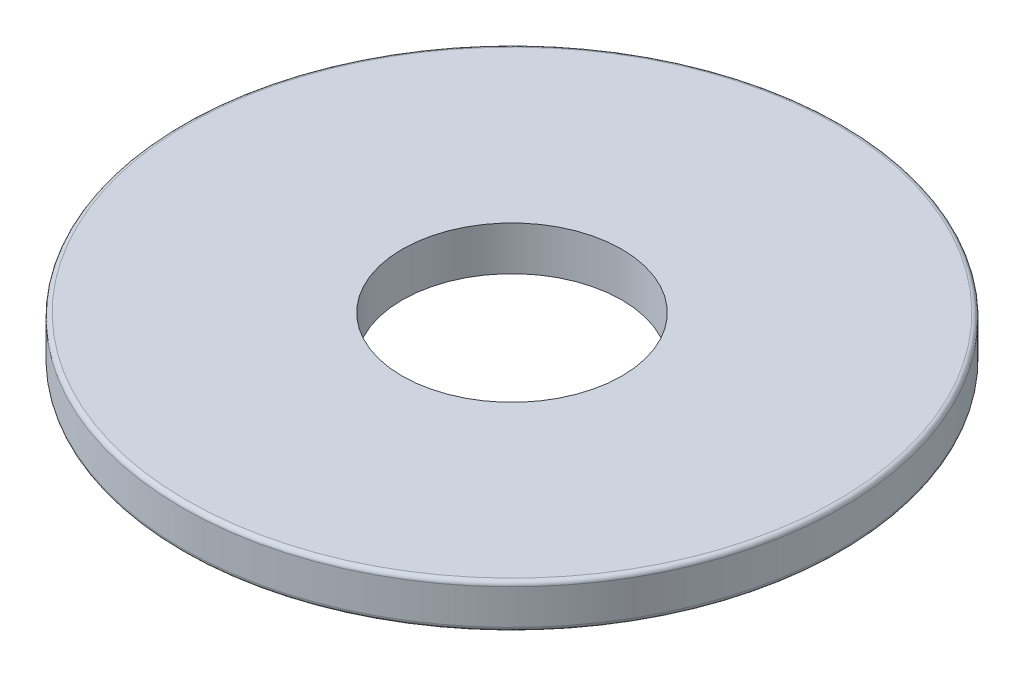
from build123d import *

# Parameters (mm, degrees)
SKETCH_1_R      = 15
SKETCH_1_R_2    = 5
EXTRUDE_1_DEPTH = 2
FILLET_1_R      = 0.2


with BuildPart() as part:
    # 草图1 → 凸台-拉伸1 (new body)
    with BuildSketch(Plane(origin=(0, 0, 0), x_dir=(1, 0, 0), z_dir=(0, 1, 0))):
        with Locations(Location((0, 0, 0), (0, 0, 270))):
            Circle(SKETCH_1_R)
        with Locations(Location((0, 0, 0), (0, 0, 270))):
            Circle(SKETCH_1_R_2, mode=Mode.SUBTRACT)
    extrude(amount=EXTRUDE_1_DEPTH)

    # 圆角1
    fillet_1_edges = [part.edges().sort_by_distance(p)[0] for p in [
        (0, 0, -15),
        (0, 2, -15),
    ]]
    fillet(fillet_1_edges, radius=FILLET_1_R)


solid = part.part
